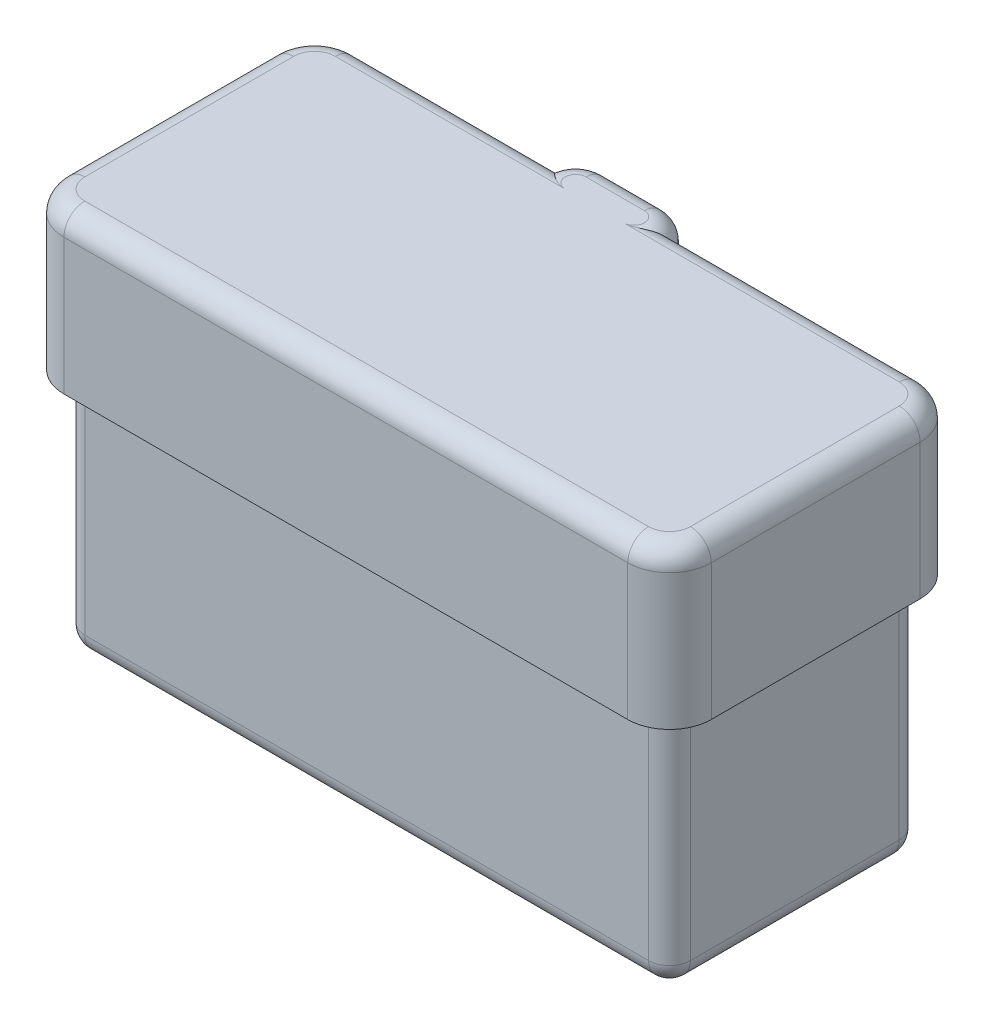
from build123d import *

# Parameters (mm, degrees)
SKETCH_1_W           = 58
SKETCH_1_H           = 24
EXTRUDE_1_DEPTH      = 23
EXTRUDE_2_DEPTH      = 20
SKETCH_3_W           = 52
SKETCH_3_H           = 18
CUT_EXTRUDE_1_DEPTH  = 15
FILLET_1_R           = 2
EXTRUDE_3_DEPTH      = 15
EXTRUDE_9_DEPTH      = 2.5
EXTRUDE_9_DEPTH_BACK = 2.5
EXTRUDE_10_DEPTH     = 5
FILLET_3_R           = 2
FILLET_4_R           = 2
SKETCH_7_R           = 1.5
SKETCH_7_R_2         = 1
CUT_EXTRUDE_2_DEPTH  = 0.1


with BuildPart() as part:
    # ｽｹｯﾁ1 → ﾎﾞｽ - 押し出し1 (new body)
    with BuildSketch(Plane(origin=(0, 0, 0), x_dir=(1, 0, 0), z_dir=(0, 1, 0))):
        Rectangle(SKETCH_1_W, SKETCH_1_H)
    extrude(amount=EXTRUDE_1_DEPTH)

    # ｽｹｯﾁ2 → ﾎﾞｽ - 押し出し2 (add)
    with BuildSketch(Plane(origin=(0, 23, 0), x_dir=(1, 0, 0), z_dir=(0, 1, 0))):
        with BuildLine():
            Line((0.6, 13), (0.6, 12))
            Line((0.6, 12), (1.6, 12))
            Line((1.6, 12), (1.6, 13))
            ThreePointArc((1.6, 13), (1.307106781, 13.707106781), (0.6, 14))
            Line((0.6, 14), (-1.4, 14))
            Line((-1.4, 14), (-1.4, 13))
            Line((-1.4, 13), (0.6, 13))
        make_face()
        with BuildLine():
            Line((-5, 14), (-3, 14))
            Line((-3, 14), (-3, 13))
            Line((-3, 13), (-5, 13))
            Line((-5, 13), (-5, 12))
            Line((-5, 12), (-6, 12))
            Line((-6, 12), (-6, 13))
            ThreePointArc((-6, 13), (-5.707106781, 13.707106781), (-5, 14))
        make_face()
    extrude(amount=-EXTRUDE_2_DEPTH)

    # ｽｹｯﾁ3 → ｶｯﾄ - 押し出し1 (cut)
    with BuildSketch(Plane(origin=(0, 23, 0), x_dir=(1, 0, 0), z_dir=(0, 1, 0))):
        Rectangle(SKETCH_3_W, SKETCH_3_H)
    extrude(amount=-CUT_EXTRUDE_1_DEPTH, mode=Mode.SUBTRACT)

    # ﾌｨﾚｯﾄ1
    fillet_1_edges = [part.edges().sort_by_distance(p)[0] for p in [
        (0, 0, 12),
        (-29, 0, 0),
        (0, 0, -12),
        (26, 15.5, -9),
        (26, 15.5, 9),
        (-26, 15.5, 9),
        (-26, 15.5, -9),
        (29, 0, 0),
        (29, 11.5, 12),
        (-29, 11.5, 12),
        (-29, 11.5, -12),
        (29, 11.5, -12),
    ]]
    fillet(fillet_1_edges, radius=FILLET_1_R)

    # ｽｹｯﾁ5 → ﾎﾞｽ - 押し出し9 (add, two sides: drawn at the far end of the back side and taken through both)
    with BuildSketch(Plane.XY.offset(-EXTRUDE_9_DEPTH_BACK)):
        with BuildLine():
            Line((-31, 24.816348491), (-31, 24))
            ThreePointArc((-31, 24), (-32.688737819, 20.928475581), (-29.19047619, 21.14816458))
            ThreePointArc((-29.19047619, 21.14816458), (-29.078178211, 21.203162816), (-29, 21.105572809))
            Line((-29, 21.105572809), (-29, 20.3))
            ThreePointArc((-29, 20.3), (-33.469686402, 21.021673504), (-31, 24.816348491))
        make_face()
    extrude(amount=EXTRUDE_9_DEPTH + EXTRUDE_9_DEPTH_BACK)

    # ｽｹｯﾁ7 → ｶｯﾄ - 押し出し2 (cut)
    with BuildSketch(Plane.XZ):
        with Locations(Location((-15, 5, 0), (0, 0, 270))):
            Circle(SKETCH_7_R)
        with Locations(Location((0, 5, 0), (0, 0, 270))):
            Circle(SKETCH_7_R)
        with Locations(Location((15, 5, 0), (0, 0, 270))):
            Circle(SKETCH_7_R)
        with Locations(Location((0, -5, 0), (0, 0, 270))):
            Circle(SKETCH_7_R_2)
        with Locations(Location((7, -5, 0), (0, 0, 270))):
            Circle(SKETCH_7_R_2)
        with Locations(Location((14, -5, 0), (0, 0, 270))):
            Circle(SKETCH_7_R_2)
        with Locations(Location((-7, -5, 0), (0, 0, 270))):
            Circle(SKETCH_7_R_2)
        with Locations(Location((-14, -5, 0), (0, 0, 270))):
            Circle(SKETCH_7_R_2)
    extrude(amount=-CUT_EXTRUDE_2_DEPTH, mode=Mode.SUBTRACT)


with BuildPart() as body_2:
    # ｽｹｯﾁ4 → ﾎﾞｽ - 押し出し3 (new body)
    with BuildSketch(Plane(origin=(0, 23, 0), x_dir=(1, 0, 0), z_dir=(0, 1, 0))):
        with BuildLine():
            Line((-31, 10), (-31, -10))
            ThreePointArc((-31, -10), (-29.828427125, -12.828427125), (-27, -14))
            Line((-27, -14), (27, -14))
            ThreePointArc((27, -14), (29.828427125, -12.828427125), (31, -10))
            Line((31, -10), (31, 10))
            ThreePointArc((31, 10), (29.828427125, 12.828427125), (27, 14))
            Line((27, 14), (3.428427125, 14))
            ThreePointArc((3.428427125, 14), (2.332050808, 15.449489743), (0.6, 16))
            Line((0.6, 16), (-2.2, 16))
            Line((-2.2, 16), (-5, 16))
            ThreePointArc((-5, 16), (-6.732050808, 15.449489743), (-7.828427125, 14))
            Line((-7.828427125, 14), (-27, 14))
            ThreePointArc((-27, 14), (-29.828427125, 12.828427125), (-31, 10))
        make_face()
        with BuildLine():
            Line((-1.4, 14), (-3, 14))
            Line((-3, 14), (-5, 14))
            ThreePointArc((-5, 14), (-5.707106781, 13.707106781), (-6, 13))
            Line((-6, 13), (-6, 12))
            Line((-6, 12), (-27, 12))
            ThreePointArc((-27, 12), (-28.414213562, 11.414213562), (-29, 10))
            Line((-29, 10), (-29, -10))
            ThreePointArc((-29, -10), (-28.414213562, -11.414213562), (-27, -12))
            Line((-27, -12), (27, -12))
            ThreePointArc((27, -12), (28.414213562, -11.414213562), (29, -10))
            Line((29, -10), (29, 10))
            ThreePointArc((29, 10), (28.414213562, 11.414213562), (27, 12))
            Line((27, 12), (1.6, 12))
            Line((1.6, 12), (1.6, 13))
            ThreePointArc((1.6, 13), (1.307106781, 13.707106781), (0.6, 14))
            Line((0.6, 14), (-1.4, 14))
        make_face(mode=Mode.SUBTRACT)
    extrude(amount=EXTRUDE_3_DEPTH)

    # ｽｹｯﾁ6 → ﾎﾞｽ - 押し出し10 (add)
    with BuildSketch(Plane(origin=(0, 38, 0), x_dir=(1, 0, 0), z_dir=(0, 1, 0))):
        with BuildLine():
            Line((0.6, 16), (-5, 16))
            ThreePointArc((-5, 16), (-6.732050808, 15.449489743), (-7.828427125, 14))
            Line((-7.828427125, 14), (-27, 14))
            ThreePointArc((-27, 14), (-29.828427125, 12.828427125), (-31, 10))
            Line((-31, 10), (-31, -10))
            ThreePointArc((-31, -10), (-29.828427125, -12.828427125), (-27, -14))
            Line((-27, -14), (27, -14))
            ThreePointArc((27, -14), (29.828427125, -12.828427125), (31, -10))
            Line((31, -10), (31, 10))
            ThreePointArc((31, 10), (29.828427125, 12.828427125), (27, 14))
            Line((27, 14), (3.428427125, 14))
            ThreePointArc((3.428427125, 14), (2.332050808, 15.449489743), (0.6, 16))
        make_face()
    extrude(amount=-EXTRUDE_10_DEPTH)

    # ﾌｨﾚｯﾄ3
    fillet_3_edges = [body_2.edges().sort_by_distance(p)[0] for p in [
        (29.828427125, 38, -12.828427125),
        (15.214213562, 38, -14),
        (-17.414213562, 38, -14),
        (-29.828427125, 38, -12.828427125),
        (-31, 38, 0),
        (-29.828427125, 38, 12.828427125),
        (0, 38, 14),
        (29.828427125, 38, 12.828427125),
        (31, 38, 0),
    ]]
    fillet(fillet_3_edges, radius=FILLET_3_R)

    # ﾌｨﾚｯﾄ4
    fillet_4_edges = [body_2.edges().sort_by_distance(p)[0] for p in [
        (-7.449489743, 38, -14.732050808),
        (-2.2, 38, -16),
        (3.049489743, 38, -14.732050808),
    ]]
    fillet(fillet_4_edges, radius=FILLET_4_R)


solid = Compound([part.part, body_2.part])
